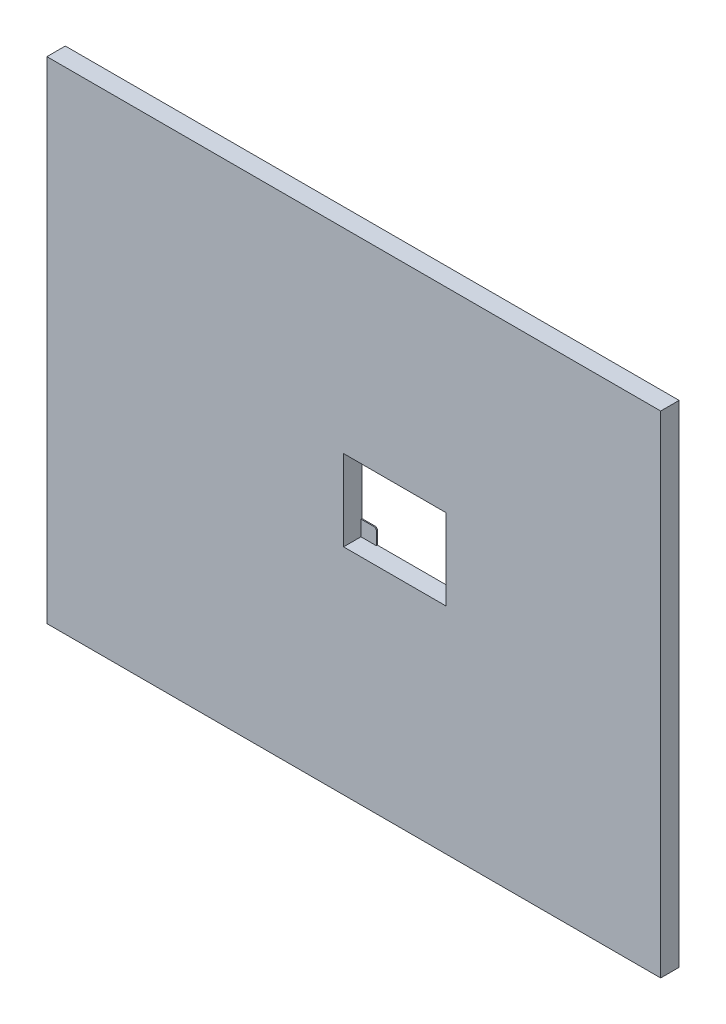
from build123d import *

# Parameters (mm, degrees)
ESQUISSE1_W             = 600
ESQUISSE1_H             = 480
BOSS_EXTRU_1_DEPTH      = 18
ESQUISSE2_W             = 100
ESQUISSE2_H             = 79
ENL_V_MAT_EXTRU_1_DEPTH = 17
ENL_V_MAT_EXTRU_3_DEPTH = 10
CONG_1_R                = 2


with BuildPart() as part:
    # Esquisse1 → Boss.-Extru.1 (new body)
    with BuildSketch(Plane.XY):
        Rectangle(ESQUISSE1_W, ESQUISSE1_H)
    extrude(amount=BOSS_EXTRU_1_DEPTH)

    # Esquisse2 → Enlèv. mat.-Extru.1 (cut)
    with BuildSketch(Plane.XY.offset(18)):
        with Locations((40, 9.5)):
            Rectangle(ESQUISSE2_W, ESQUISSE2_H)
    extrude(amount=-ENL_V_MAT_EXTRU_1_DEPTH, mode=Mode.SUBTRACT)

    # Esquisse4 → Enlèv. mat.-Extru.3 (cut)
    with BuildSketch(Plane.XY.offset(1)):
        Polygon((75, 49), (5, 49), (5, 34), (-10, 34), (-10, -15), (5, -15), (5, -30), (75, -30), (75, -15), (90, -15), (90, 34), (75, 34), align=None)
    extrude(amount=-ENL_V_MAT_EXTRU_3_DEPTH, mode=Mode.SUBTRACT)

    # Congé1
    cong_1_edges = [part.edges().sort_by_distance(p)[0] for p in [
        (5, -15, 0.5),
        (5, 34, 0.5),
        (75, 34, 0.5),
        (75, -15, 0.5),
    ]]
    fillet(cong_1_edges, radius=CONG_1_R)


solid = part.part
